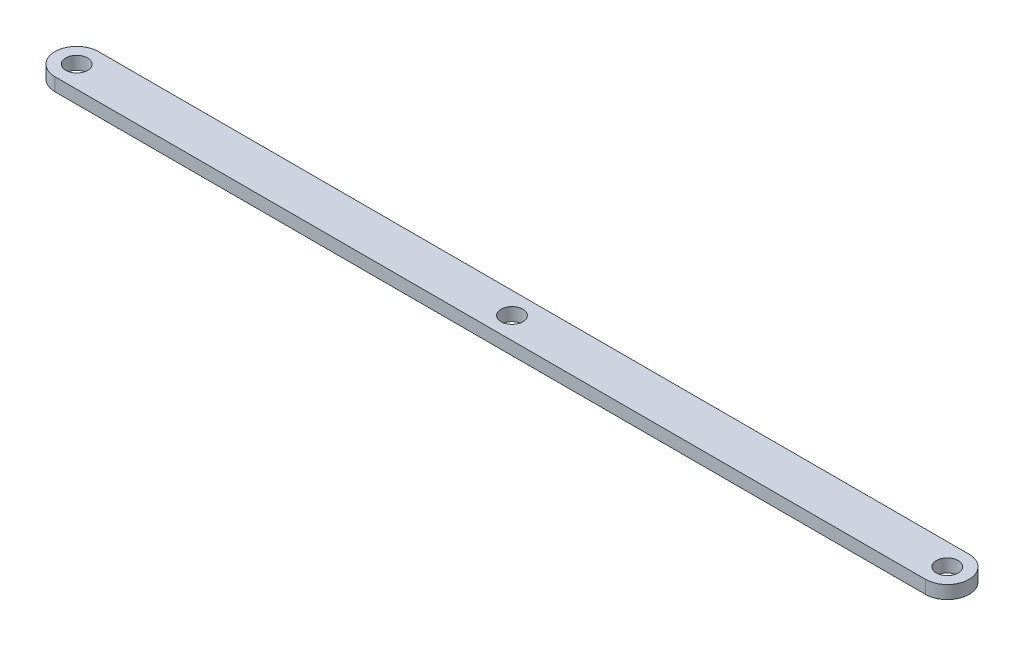
from build123d import *

# Parameters (mm, degrees)
BOSS_EXTRUDE1_DEPTH = 3
CUT_EXTRUDE1_REACH  = 107.162
SKETCH3_R           = 2.5
CUT_EXTRUDE2_REACH  = 107.162
SKETCH5_R           = 2.5


with BuildPart() as part:
    # Sketch2 → Boss-Extrude1 (new body)
    with BuildSketch(Plane(origin=(0, 0, 0), x_dir=(1, 0, 0), z_dir=(0, 1, 0))):
        with BuildLine():
            Line((-100, 5), (100, 5))
            ThreePointArc((100, 5), (105, 0), (100, -5))
            Line((100, -5), (-100, -5))
            ThreePointArc((-100, -5), (-105, 0), (-100, 5))
        make_face()
    extrude(amount=BOSS_EXTRUDE1_DEPTH)

    # Sketch3 → Cut-Extrude1 (cut, up to next)
    with BuildSketch(Plane(origin=(0, 3, 0), x_dir=(1, 0, 0), z_dir=(0, 1, 0)), mode=Mode.PRIVATE) as cut_extrude1_sk1:
        with Locations(Location((100, 0, 0), (0, 0, 270))):
            Circle(SKETCH3_R)
    cut_extrude1_tool1 = extrude(cut_extrude1_sk1.sketch, amount=-CUT_EXTRUDE1_REACH, mode=Mode.PRIVATE) & part.part
    cut_extrude1 = cut_extrude1_tool1.solids().sort_by_distance((100, 3, 0))[0]
    add(cut_extrude1, mode=Mode.SUBTRACT)

    # Mirror1: Cut-Extrude1 across plane
    add(cut_extrude1.mirror(Plane(origin=(0, 0, 0), x_dir=(0, 0, 1), z_dir=(1, 0, 0))), mode=Mode.SUBTRACT)

    # Sketch5 → Cut-Extrude2 (cut, up to next)
    with BuildSketch(Plane.XZ, mode=Mode.PRIVATE) as cut_extrude2_sk1:
        with Locations(Location((0, 0, 0), (0, 0, 270))):
            Circle(SKETCH5_R)
    cut_extrude2_tool1 = extrude(cut_extrude2_sk1.sketch, amount=-CUT_EXTRUDE2_REACH, mode=Mode.PRIVATE) & part.part
    add(cut_extrude2_tool1.solids().sort_by_distance((0, 0, 0))[0], mode=Mode.SUBTRACT)


solid = part.part
